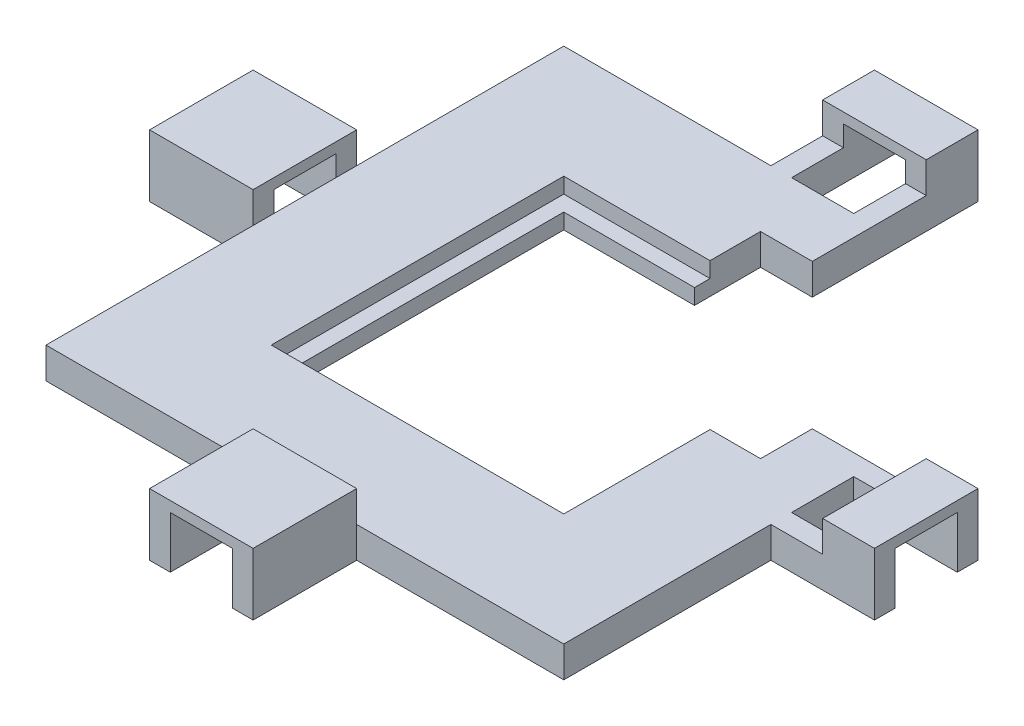
from build123d import *

# Parameters (mm, degrees)
BOSS_EXTRUDE10_DEPTH = 12
SKETCH6_W            = 100
SKETCH6_H            = 100
CUT_EXTRUDE1_DEPTH   = 6
SKETCH7_W            = 20
SKETCH7_H            = 12
SKETCH7_W_2          = 12
SKETCH7_H_2          = 20
CUT_EXTRUDE2_DEPTH   = 10
SKETCH8_W            = 56.5
SKETCH8_H            = 56.5
CUT_EXTRUDE3_DEPTH   = 3
SKETCH10_W           = 20
SKETCH10_H           = 10
SKETCH10_W_2         = 10
SKETCH10_H_2         = 20
CUT_EXTRUDE6_DEPTH   = 6
SKETCH11_W           = 10
SKETCH11_H           = 12.75
SKETCH11_W_2         = 12.75
SKETCH11_H_2         = 10
CUT_EXTRUDE7_DEPTH   = 100.176610146


with BuildPart() as part:
    # Sketch1 → Boss-Extrude10 (new body)
    with BuildSketch(Plane(origin=(0, 0, 0), x_dir=(1, 0, 0), z_dir=(0, 1, 0))):
        Polygon((-50, 50), (-10, 50), (-10, 70), (10, 70), (10, 25.25), (-25.25, 25.25), (-25.25, -25.25), (25.25, -25.25), (25.25, 10), (70, 10), (70, -10), (50, -10), (50, -50), (10, -50), (10, -70), (-10, -70), (-10, -50), (-50, -50), (-50, -10), (-70, -10), (-70, 10), (-50, 10), align=None)
    extrude(amount=BOSS_EXTRUDE10_DEPTH)

    # Sketch6 → Cut-Extrude1 (cut)
    with BuildSketch(Plane(origin=(0, 12, 0), x_dir=(1, 0, 0), z_dir=(0, 1, 0))):
        Rectangle(SKETCH6_W, SKETCH6_H)
    extrude(amount=-CUT_EXTRUDE1_DEPTH, mode=Mode.SUBTRACT)

    # Sketch7 → Cut-Extrude2 (cut)
    with BuildSketch(Plane(origin=(0, 0, 0), x_dir=(-1, 0, 0), z_dir=(0, -1, 0))):
        with Locations((60, 0)):
            Rectangle(SKETCH7_W, SKETCH7_H)
        with Locations((0, -60)):
            Rectangle(SKETCH7_W_2, SKETCH7_H_2)
        with Locations((-60, 0)):
            Rectangle(SKETCH7_W, SKETCH7_H)
        with Locations((0, 60)):
            Rectangle(SKETCH7_W_2, SKETCH7_H_2)
    extrude(amount=-CUT_EXTRUDE2_DEPTH, mode=Mode.SUBTRACT)

    # Sketch8 → Cut-Extrude3 (cut)
    with BuildSketch(Plane(origin=(0, 6, 0), x_dir=(1, 0, 0), z_dir=(0, 1, 0))):
        Rectangle(SKETCH8_W, SKETCH8_H)
    extrude(amount=-CUT_EXTRUDE3_DEPTH, mode=Mode.SUBTRACT)

    # Sketch10 → Cut-Extrude6 (cut)
    with BuildSketch(Plane(origin=(0, 12, 0), x_dir=(1, 0, 0), z_dir=(0, 1, 0))):
        with Locations((0, 55)):
            Rectangle(SKETCH10_W, SKETCH10_H)
        with Locations((55, 0)):
            Rectangle(SKETCH10_W_2, SKETCH10_H_2)
    extrude(amount=-CUT_EXTRUDE6_DEPTH, mode=Mode.SUBTRACT)

    # Sketch11 → Cut-Extrude7 (cut, through all)
    with BuildSketch(Plane(origin=(0, 6, 0), x_dir=(1, 0, 0), z_dir=(0, 1, 0))):
        with Locations((5, 31.625)):
            Rectangle(SKETCH11_W, SKETCH11_H)
        with Locations((31.625, 5)):
            Rectangle(SKETCH11_W_2, SKETCH11_H_2)
    extrude(amount=-CUT_EXTRUDE7_DEPTH, mode=Mode.SUBTRACT)


solid = part.part
